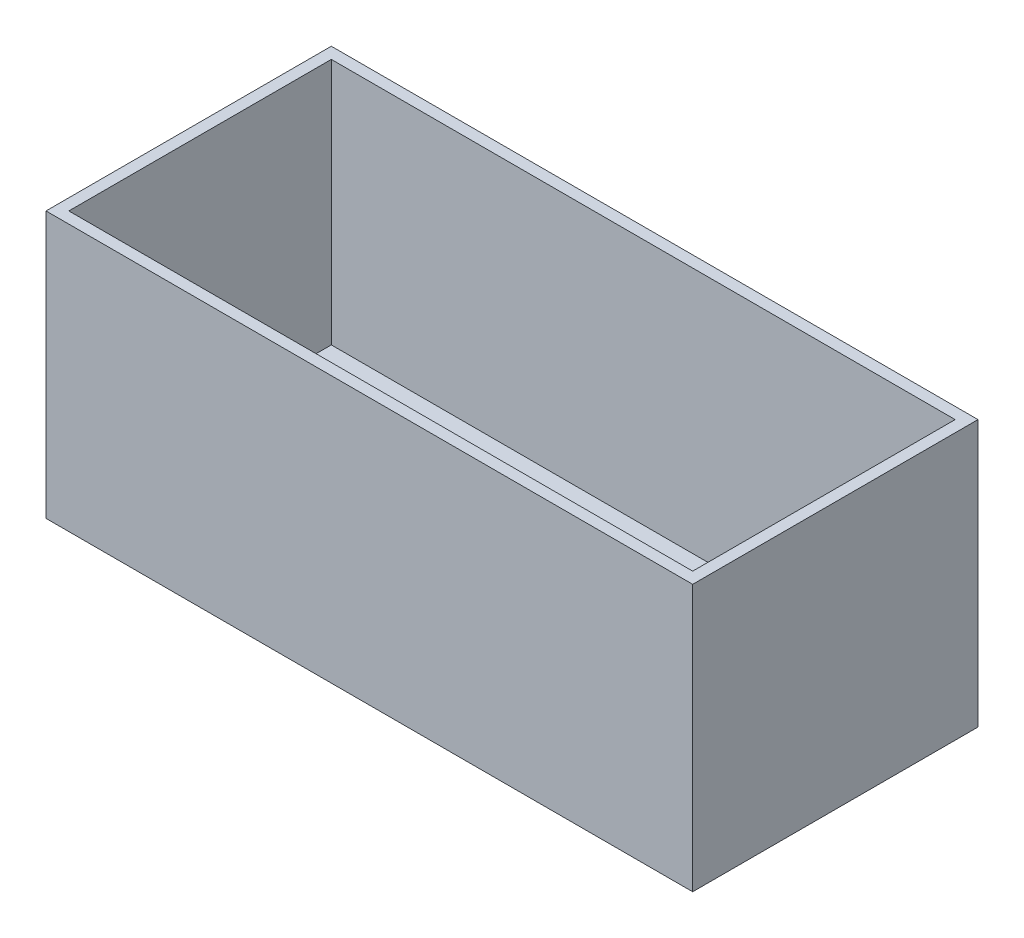
from build123d import *

# Parameters (mm, degrees)
SKETCH2_W           = 170
SKETCH2_H           = 75
BOSS_EXTRUDE2_DEPTH = 5
EXTRUDE_THIN1_START = 5
SKETCH2_3_W         = 170
SKETCH2_3_H         = 75
SKETCH2_3_W_2       = 164
SKETCH2_3_H_2       = 69
EXTRUDE_THIN1_DEPTH = 65
SKETCH2_6_R         = 2.2
CUT_EXTRUDE1_DEPTH  = 6


with BuildPart() as part:
    # Sketch2 → Boss-Extrude2 (new body)
    with BuildSketch(Plane(origin=(0, 0, 0), x_dir=(1, 0, 0), z_dir=(0, 1, 0))):
        Rectangle(SKETCH2_W, SKETCH2_H)
    extrude(amount=BOSS_EXTRUDE2_DEPTH)

    # Sketch2<3> → Extrude-Thin1 (add)
    with BuildSketch(Plane(origin=(0, 0, 0), x_dir=(1, 0, 0), z_dir=(0, 1, 0)).offset(EXTRUDE_THIN1_START)):
        Rectangle(SKETCH2_3_W, SKETCH2_3_H)
        Rectangle(SKETCH2_3_W_2, SKETCH2_3_H_2, mode=Mode.SUBTRACT)
    extrude(amount=EXTRUDE_THIN1_DEPTH)

    # Sketch2<6> → Cut-Extrude1 (cut)
    with BuildSketch(Plane(origin=(0, 0, 0), x_dir=(1, 0, 0), z_dir=(0, 1, 0))):
        with Locations(Location((-67.65, 14.9, 0), (0, 0, 270))):
            Circle(SKETCH2_6_R)
        with Locations(Location((67.65, 14.9, 0), (0, 0, 90))):
            Circle(SKETCH2_6_R)
        with Locations(Location((67.65, -27.9, 0), (0, 0, 270))):
            Circle(SKETCH2_6_R)
        with Locations(Location((-67.65, -27.9, 0), (0, 0, 90))):
            Circle(SKETCH2_6_R)
    extrude(amount=CUT_EXTRUDE1_DEPTH, mode=Mode.SUBTRACT)


solid = part.part
